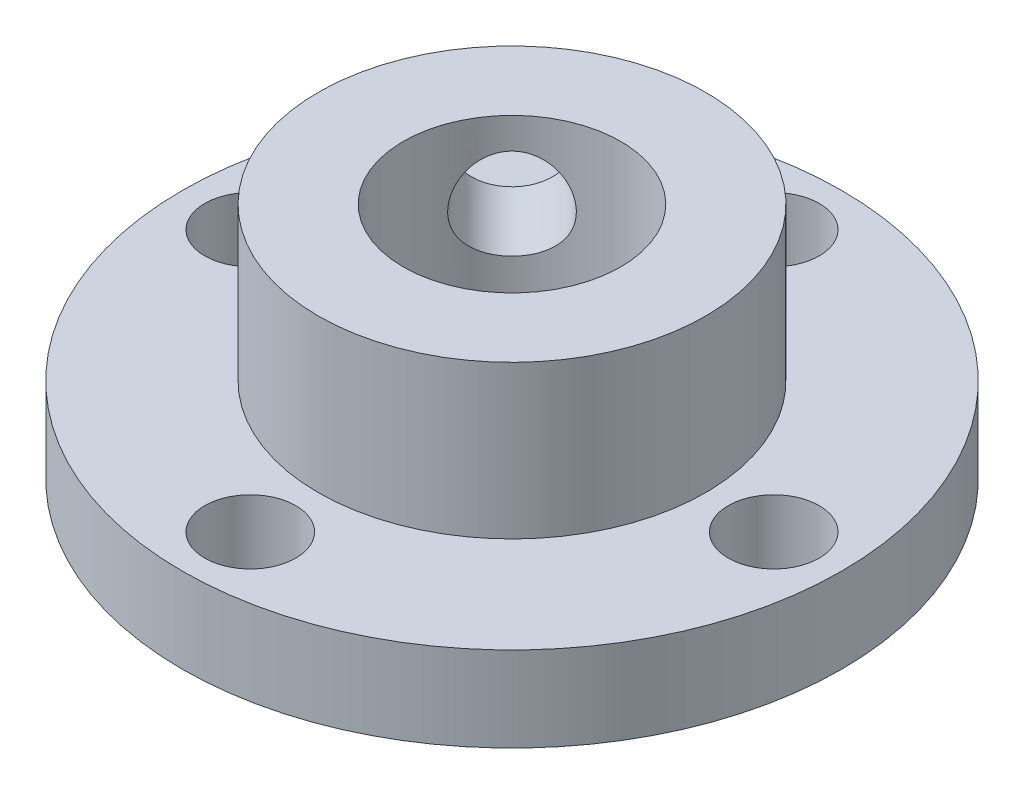
from build123d import *

# Parameters (mm, degrees)
SKETCH1_R                      = 7.239
SKETCH1_R_2                    = 4.064
BOSS_EXTRUDE1_DEPTH            = 8.89
SKETCH1_3_R                    = 12.319
SKETCH1_3_R_2                  = 7.239
BOSS_EXTRUDE2_DEPTH            = 3.175
SKETCH2_R                      = 1.7
CUT_EXTRUDE1_DEPTH             = 3.175
CUT_EXTRUDE2_REACH             = 27.909
SKETCH5_R                      = 1.7
CUT_EXTRUDE2_DIRECTION_2_REACH = 27.909


with BuildPart() as part:
    # Sketch1 → Boss-Extrude1 (new body)
    with BuildSketch(Plane(origin=(0, 0, 0), x_dir=(1, 0, 0), z_dir=(0, 1, 0))):
        Circle(SKETCH1_R)
        Circle(SKETCH1_R_2, mode=Mode.SUBTRACT)
    extrude(amount=BOSS_EXTRUDE1_DEPTH)

    # Sketch1<3> → Boss-Extrude2 (add)
    with BuildSketch(Plane(origin=(0, 0, 0), x_dir=(1, 0, 0), z_dir=(0, 1, 0))):
        Circle(SKETCH1_3_R)
        Circle(SKETCH1_3_R_2, mode=Mode.SUBTRACT)
    extrude(amount=BOSS_EXTRUDE2_DEPTH)

    # Sketch2 → Cut-Extrude1 (cut)
    with BuildSketch(Plane(origin=(0, 3.175, 0), x_dir=(1, 0, 0), z_dir=(0, 1, 0))):
        with Locations((0, 9.779)):
            Circle(SKETCH2_R)
        with Locations((9.779, 0)):
            Circle(SKETCH2_R)
        with Locations((0, -9.779)):
            Circle(SKETCH2_R)
        with Locations((-9.779, 0)):
            Circle(SKETCH2_R)
    extrude(amount=-CUT_EXTRUDE1_DEPTH, mode=Mode.SUBTRACT)

    # Sketch5 → Cut-Extrude2 (cut, up to next)
    with BuildSketch(Plane(origin=(-4.8895, 0, -4.8895), x_dir=(-0.7071067811865475, 0, 0.7071067811865477), z_dir=(-0.7071067811865477, 0, -0.7071067811865475)), mode=Mode.PRIVATE) as cut_extrude2_sk1:
        with Locations((0, 6.0325)):
            Circle(SKETCH5_R)
    cut_extrude2_tool1 = extrude(cut_extrude2_sk1.sketch, amount=-CUT_EXTRUDE2_REACH, mode=Mode.PRIVATE) & part.part
    add(cut_extrude2_tool1.solids().sort_by_distance((-4.8895, 6.0325, -4.8895))[0], mode=Mode.SUBTRACT)

    # Sketch5 → Cut-Extrude2 direction 2 (cut, up to next)
    with BuildSketch(Plane(origin=(-4.8895, 0, -4.8895), x_dir=(-0.7071067811865475, 0, 0.7071067811865477), z_dir=(-0.7071067811865477, 0, -0.7071067811865475)), mode=Mode.PRIVATE) as cut_extrude2_direction_2_sk1:
        with Locations((0, 6.0325)):
            Circle(SKETCH5_R)
    cut_extrude2_direction_2_tool1 = extrude(cut_extrude2_direction_2_sk1.sketch, amount=CUT_EXTRUDE2_DIRECTION_2_REACH, mode=Mode.PRIVATE) & part.part
    add(cut_extrude2_direction_2_tool1.solids().sort_by_distance((-4.8895, 6.0325, -4.8895))[0], mode=Mode.SUBTRACT)


solid = part.part
